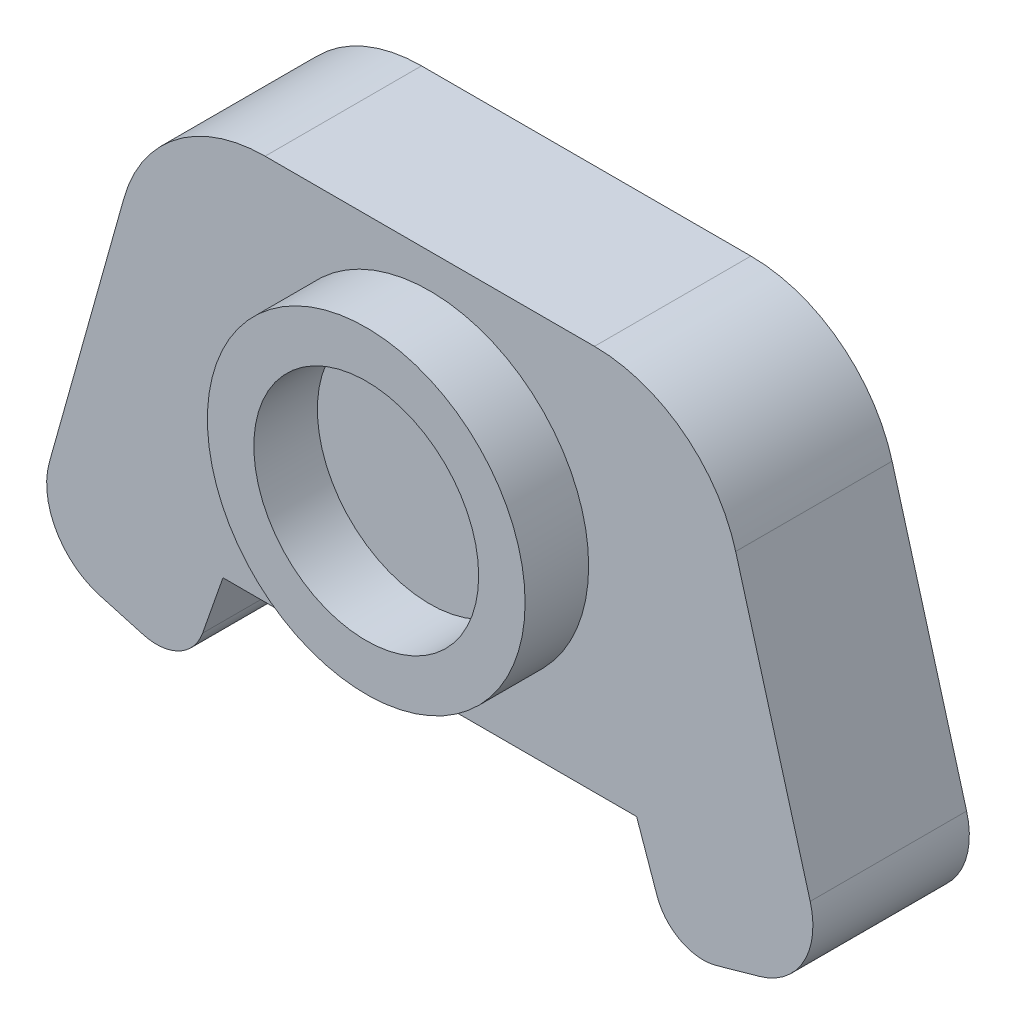
from build123d import *

# Parameters (mm, degrees)
BOSS_EXTRUDE1_DEPTH = 3.2
SKETCH3_R           = 3.25
SKETCH3_R_2         = 2.3
BOSS_EXTRUDE2_DEPTH = 1.3
FILLET1_R           = 3
FILLET2_R           = 1.5
FILLET3_R           = 1


with BuildPart() as part:
    # Sketch2 → Boss-Extrude1 (new body)
    with BuildSketch(Plane.XY):
        Polygon((-5.64375, 3.51875), (5.64375, 3.51875), (8.187159214, -5.552325228), (4.958101353, -6.457710236), (4.23125, -4.38125), (-4.23125, -4.38125), (-4.958101353, -6.457710236), (-8.187159214, -5.552325228), align=None)
    extrude(amount=BOSS_EXTRUDE1_DEPTH)

    # Sketch3 → Boss-Extrude2 (add)
    with BuildSketch(Plane.XY.offset(3.2)):
        with Locations((0, -0.43125)):
            Circle(SKETCH3_R)
        with Locations((0, -0.43125)):
            Circle(SKETCH3_R_2, mode=Mode.SUBTRACT)
    extrude(amount=BOSS_EXTRUDE2_DEPTH)

    # Fillet1
    fillet1_edges = [part.edges().sort_by_distance(p)[0] for p in [
        (-5.64375, 3.51875, 1.6),
        (5.64375, 3.51875, 1.6),
    ]]
    fillet(fillet1_edges, radius=FILLET1_R)

    # Fillet2
    fillet2_edges = [part.edges().sort_by_distance(p)[0] for p in [
        (8.187159214, -5.552325228, 1.6),
        (-8.187159214, -5.552325228, 1.6),
    ]]
    fillet(fillet2_edges, radius=FILLET2_R)

    # Fillet3
    fillet3_edges = [part.edges().sort_by_distance(p)[0] for p in [
        (4.958101353, -6.457710236, 1.6),
        (-4.958101353, -6.457710236, 1.6),
    ]]
    fillet(fillet3_edges, radius=FILLET3_R)


solid = part.part
